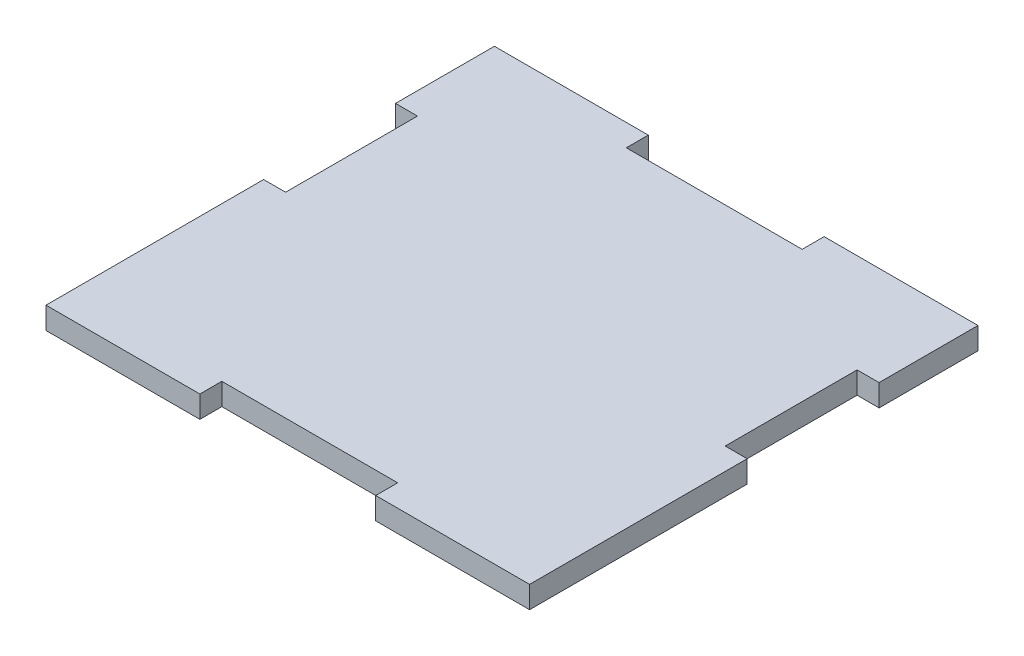
from build123d import *

# Parameters (mm, degrees)
EXTRUDE_1_DEPTH = 5


with BuildPart() as part:
    # 草图1 → 凸台-拉伸1 (new body)
    with BuildSketch(Plane(origin=(0, 0, 0), x_dir=(1, 0, 0), z_dir=(0, 1, 0))):
        Polygon((75, 102), (110, 102), (110, 79.5), (105, 79.5), (105, 49.5), (110, 49.5), (110, 0), (75, 0), (75, 5), (35, 5), (35, 0), (0, 0), (0, 49.5), (5, 49.5), (5, 79.5), (0, 79.5), (0, 102), (35, 102), (35, 97), (75, 97), align=None)
    extrude(amount=EXTRUDE_1_DEPTH)


solid = part.part
